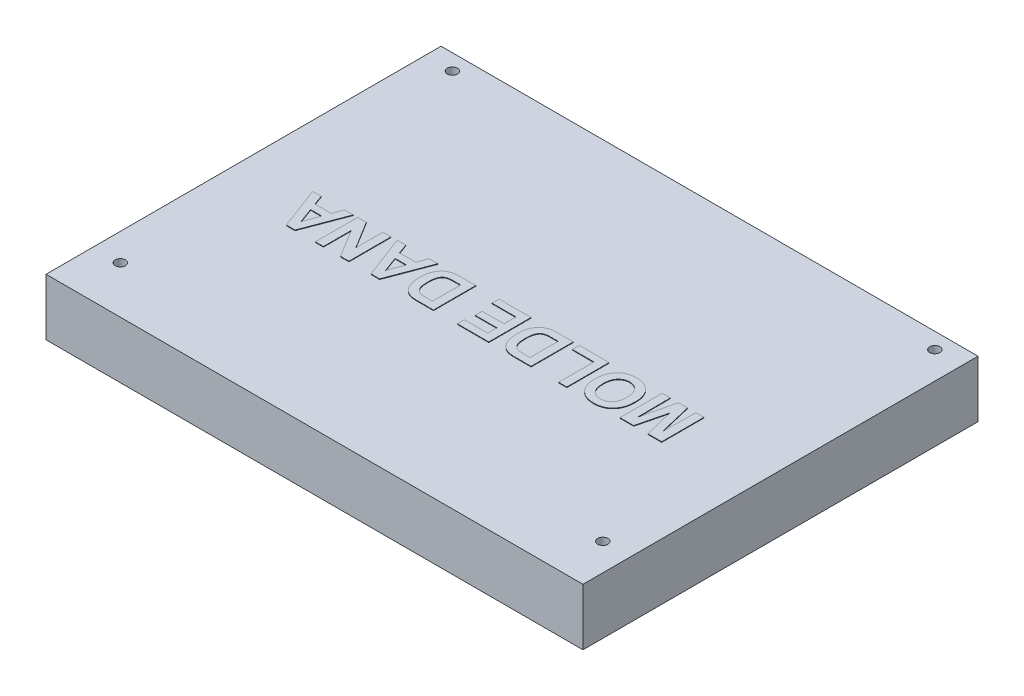
from build123d import *

# Parameters (mm, degrees)
CROQUIS1_W              = 946
CROQUIS1_H              = 696
SALIENTE_EXTRUIR1_DEPTH = 100
CROQUIS2_R              = 9
CORTAR_EXTRUIR1_DEPTH   = 120
SALIENTE_EXTRUIR2_DEPTH = 1


with BuildPart() as part:
    # Croquis1 → Saliente-Extruir1 (new body)
    with BuildSketch(Plane(origin=(0, 0, 0), x_dir=(1, 0, 0), z_dir=(0, 1, 0))):
        with Locations((473, -348)):
            Rectangle(CROQUIS1_W, CROQUIS1_H)
    extrude(amount=SALIENTE_EXTRUIR1_DEPTH)

    # Croquis2 → Cortar-Extruir1 (cut)
    with BuildSketch(Plane(origin=(0, 100, 0), x_dir=(1, 0, 0), z_dir=(0, 1, 0))):
        with Locations(Location((48, -28, 0), (0, 0, 270))):
            Circle(CROQUIS2_R)
        with Locations(Location((898, -28, 0), (0, 0, 270))):
            Circle(CROQUIS2_R)
        with Locations(Location((48, -613, 0), (0, 0, 270))):
            Circle(CROQUIS2_R)
        with Locations(Location((898, -613, 0), (0, 0, 270))):
            Circle(CROQUIS2_R)
    extrude(amount=-CORTAR_EXTRUIR1_DEPTH, mode=Mode.SUBTRACT)

    # Croquis3 → Saliente-Extruir2 (add)
    # profile 1 of 9: a face of its own
    with BuildSketch(Plane(origin=(0, 100, 0), x_dir=(1, 0, 0), z_dir=(0, 1, 0))):
        Polygon((798.887818585, -335.700738439), (798.887818585, -410.181980301), (774.657542787, -410.181980301), (762.124641512, -359.378969777), (749.591740237, -410.181980301), (725.361464439, -410.181980301), (725.361464439, -335.700738439), (739.684780182, -335.700738439), (740.16222404, -394.336812261), (754.14237701, -335.700738439), (770.106906014, -335.700738439), (784.087058984, -394.336812261), (784.564502842, -335.700738439), align=None)
    # profile 2 of 9: a face of its own
    with BuildSketch(Plane(origin=(0, 100, 0), x_dir=(1, 0, 0), z_dir=(0, 1, 0))):
        with BuildLine():
            add(Edge.make_bspline(
                [(714.857699561, -372.493755753), (714.852428828, -373.414164201), (714.842077788, -375.221727585), (714.662718292, -377.873490928), (714.426308503, -380.415305104), (714.041315543, -382.837172219), (713.588423265, -385.150427442), (713.021975224, -387.354384123), (712.339605922, -389.441313045), (711.796775742, -390.773794605), (711.530512675, -391.427388751)],
                knots=[0, 0, 0, 0, 1.141009212, 2.240794809, 3.294380675, 4.305229195, 5.280013876, 6.216333343, 7.125095522, 8, 8, 8, 8], degree=3))
            add(Edge.make_bspline(
                [(711.530512675, -391.427388751), (711.095480699, -392.356695793), (710.230533434, -394.204379706), (708.618251174, -396.816123835), (706.805655437, -399.289347503), (704.784677128, -401.591628838), (702.606242973, -403.680677599), (700.284978991, -405.482738713), (697.881833428, -407.040419256), (696.17328357, -407.82434717), (695.327261741, -408.212524387)],
                knots=[0, 0, 0, 0, 1.031298788, 2.050467816, 3.080965632, 4.112446372, 5.127889083, 6.11150152, 7.064873096, 8, 8, 8, 8], degree=3))
            add(Edge.make_bspline(
                [(695.327261741, -408.212524387), (694.752952457, -408.448093241), (693.592126959, -408.924237958), (691.788067496, -409.518491515), (689.915556915, -410.001295669), (687.988138966, -410.432866331), (685.987100029, -410.730448503), (683.928609336, -410.979960924), (681.801401466, -411.110734725), (680.362531091, -411.128062178), (679.631294906, -411.136868018)],
                knots=[0, 0, 0, 0, 0.92659354, 1.872881803, 2.832850937, 3.813025581, 4.820167273, 5.851730198, 6.908245912, 8, 8, 8, 8], degree=3))
            add(Edge.make_bspline(
                [(679.631294906, -411.136868018), (678.321959841, -411.10404732), (675.759573122, -411.039816762), (672.016646521, -410.5758862), (668.474698355, -409.792499061), (665.145732787, -408.660206351), (662.000995707, -407.244843413), (659.065112994, -405.489145774), (656.333018538, -403.412570376), (653.812712687, -401.041875011), (651.536817604, -398.389829724), (649.58296911, -395.453064358), (647.893630337, -392.292197444), (646.545652542, -388.86846156), (645.476432475, -385.2091067), (644.753360681, -381.299307222), (644.269583066, -377.150992311), (644.220970136, -374.300551446), (644.196008564, -372.836918526)],
                knots=[0, 0, 0, 0, 1.064696, 2.083624705, 3.061957999, 4.009747969, 4.938330204, 5.861603005, 6.7854338, 7.723969795, 8.670714893, 9.62089252, 10.587110806, 11.580050613, 12.60789951, 13.682772805, 14.810159493, 16, 16, 16, 16], degree=3))
            add(Edge.make_bspline(
                [(644.196008564, -372.836918526), (644.222790782, -371.383426738), (644.274930757, -368.553749779), (644.733237149, -364.432893143), (645.464305044, -360.549477374), (646.530208551, -356.916347279), (647.866633654, -353.512542352), (649.53812135, -350.370372913), (651.476260104, -347.447381555), (653.743382419, -344.811791892), (656.237358275, -342.438187973), (658.96338644, -340.385272187), (661.868536596, -338.619495665), (664.997626323, -337.201053723), (668.324336575, -336.097387637), (671.847024819, -335.306492304), (675.570564481, -334.842452182), (678.118068741, -334.778562698), (679.422413218, -334.745850723)],
                knots=[0, 0, 0, 0, 1.188494359, 2.313776472, 3.386789709, 4.416594438, 5.406132604, 6.372361755, 7.322313154, 8.268721933, 9.209651099, 10.133050987, 11.054612279, 11.984787818, 12.936688123, 13.916631539, 14.933297114, 16, 16, 16, 16], degree=3))
            add(Edge.make_bspline(
                [(679.422413218, -334.745850723), (680.741557293, -334.779094807), (683.323501215, -334.84416303), (687.093062907, -335.301740092), (690.650615346, -336.103386686), (694.011370981, -337.17668136), (697.151550532, -338.61401314), (700.09116678, -340.342573395), (702.810213389, -342.410886125), (705.310813149, -344.765306973), (707.57735218, -347.387375809), (709.511271312, -350.292621218), (711.187762912, -353.406988382), (712.520507469, -356.777564246), (713.590090026, -360.369694056), (714.319107211, -364.20404046), (714.779133909, -368.270052222), (714.831032335, -371.06012091), (714.857699561, -372.493755753)],
                knots=[0, 0, 0, 0, 1.08084049, 2.115515346, 3.105177409, 4.065258586, 5.000819201, 5.92894832, 6.854012731, 7.793841493, 8.738859725, 9.687140885, 10.647913701, 11.631668285, 12.651600344, 13.714546555, 14.825654111, 16, 16, 16, 16], degree=3))
        make_face()
        with BuildLine():
            add(Edge.make_bspline(
                [(700.534383818, -372.986119732), (700.520083699, -371.955843467), (700.49239179, -369.96073308), (700.19713892, -367.064942854), (699.749660286, -364.357549625), (699.089551764, -361.842690295), (698.261604188, -359.51283001), (697.225471036, -357.384892459), (696.017288866, -355.438849945), (694.605547049, -353.712607316), (693.06566295, -352.174287535), (691.428577223, -350.823367943), (689.673898183, -349.692091398), (687.823313077, -348.764415077), (685.868911957, -348.050380938), (683.823270179, -347.51527508), (681.66893423, -347.2228342), (680.199072949, -347.180765601), (679.45225346, -347.159391034)],
                knots=[0, 0, 0, 0, 1.313926443, 2.544393562, 3.709525234, 4.811404508, 5.857066262, 6.858762239, 7.825215948, 8.772527565, 9.696737363, 10.598503724, 11.474937107, 12.35455699, 13.23381067, 14.12482115, 15.047243349, 16, 16, 16, 16], degree=3))
            add(Edge.make_bspline(
                [(679.45225346, -347.159391034), (678.705331221, -347.18032999), (677.235267715, -347.221541235), (675.083609048, -347.52001655), (673.03379973, -348.032091123), (671.087530973, -348.743078655), (669.2549541, -349.685732091), (667.511092345, -350.803718038), (665.884951116, -352.145506873), (664.352700989, -353.664075764), (662.978964335, -355.400828544), (661.778938512, -357.343187989), (660.758620838, -359.488197062), (659.954572785, -361.846344276), (659.281560354, -364.390338294), (658.860669742, -367.151419884), (658.560571832, -370.10488934), (658.533343023, -372.144771026), (658.519324306, -373.19500142)],
                knots=[0, 0, 0, 0, 0.949335378, 1.868445233, 2.754701665, 3.630798016, 4.495968556, 5.369254738, 6.258887054, 7.1708374, 8.106838367, 9.066474704, 10.067532548, 11.119232831, 12.229391465, 13.408003623, 14.665514087, 16, 16, 16, 16], degree=3))
            add(Edge.make_bspline(
                [(658.519324306, -373.19500142), (658.535359813, -374.235044059), (658.566414094, -376.249185457), (658.837235399, -379.166012476), (659.279950429, -381.879911225), (659.899235797, -384.393668154), (660.706941214, -386.700231531), (661.674382848, -388.814203935), (662.841093015, -390.718357423), (664.189705637, -392.411892693), (665.691557352, -393.893122107), (667.308760848, -395.181099041), (669.039906937, -396.285533102), (670.893172852, -397.179844255), (672.870976537, -397.871943887), (674.962371534, -398.356473997), (677.170368865, -398.664050858), (678.680342495, -398.703275664), (679.45225346, -398.723327707)],
                knots=[0, 0, 0, 0, 1.332005769, 2.579555744, 3.748367139, 4.851568227, 5.891207845, 6.874533533, 7.824010729, 8.744315661, 9.640762401, 10.520275634, 11.388035792, 12.265608818, 13.150114554, 14.066441968, 15.011549198, 16, 16, 16, 16], degree=3))
            add(Edge.make_bspline(
                [(679.45225346, -398.723327707), (680.224173574, -398.703316192), (681.734165101, -398.664170668), (683.942034008, -398.356024918), (686.040086235, -397.872120865), (688.023997568, -397.16877603), (689.87804104, -396.248899974), (691.629920443, -395.153290594), (693.262337259, -393.84747191), (694.769421719, -392.337459277), (696.139227876, -390.630043495), (697.320673053, -388.703186273), (698.31590209, -386.573497296), (699.14367366, -384.247048977), (699.753025338, -381.713733497), (700.222309841, -378.988753465), (700.485620675, -376.054908662), (700.517780087, -374.031034875), (700.534383818, -372.986119732)],
                knots=[0, 0, 0, 0, 0.981836838, 1.920620126, 2.830816172, 3.717479053, 4.591954799, 5.459257691, 6.341778587, 7.245639417, 8.16867914, 9.120509358, 10.114083048, 11.154838822, 12.256798236, 13.425077972, 14.670581616, 16, 16, 16, 16], degree=3))
        make_face(mode=Mode.SUBTRACT)
    # profile 3 of 9: a face of its own
    with BuildSketch(Plane(origin=(0, 100, 0), x_dir=(1, 0, 0), z_dir=(0, 1, 0))):
        Polygon((631.782468253, -335.700738439), (631.782468253, -410.181980301), (617.459152511, -410.181980301), (617.459152511, -348.11427875), (579.263643864, -348.11427875), (579.263643864, -335.700738439), align=None)
    # profile 4 of 9: a face of its own
    with BuildSketch(Plane(origin=(0, 100, 0), x_dir=(1, 0, 0), z_dir=(0, 1, 0))):
        with BuildLine():
            Line((568.759878986, -410.181980301), (541.441138231, -410.181980301))
            add(Edge.make_bspline(
                [(541.441138231, -410.181980301), (540.695019069, -410.182367098), (539.242151745, -410.18312028), (537.133660888, -410.095648533), (535.161950861, -410.007663462), (533.332680959, -409.831536591), (531.639504891, -409.6469244), (530.079384295, -409.413191472), (528.662174554, -409.113637144), (527.768482895, -408.877402723), (527.341624296, -408.764568848)],
                knots=[0, 0, 0, 0, 1.259756885, 2.453039283, 3.563158368, 4.591894114, 5.55549294, 6.43918076, 7.254497783, 8, 8, 8, 8], degree=3))
            add(Edge.make_bspline(
                [(527.341624296, -408.764568848), (526.806888449, -408.592717936), (525.745278458, -408.251542671), (524.203956264, -407.614414732), (522.714222429, -406.906660229), (521.284945855, -406.091228808), (519.916410618, -405.187504074), (518.613250111, -404.175811703), (517.358365416, -403.089660238), (515.762313821, -401.51241912), (513.939797651, -399.32432632), (512.021816066, -396.433299491), (510.393933592, -393.256700081), (509.266833511, -390.415244959), (508.518688017, -387.989445477), (508.027187023, -386.042154142), (507.608773711, -383.99160098), (507.289969812, -381.833276789), (507.017702799, -379.58021865), (506.821866174, -377.221469837), (506.725001879, -374.757454605), (506.703266702, -373.080681621), (506.692177434, -372.225193583)],
                knots=[0, 0, 0, 0, 0.745437516, 1.479915586, 2.212342825, 2.933884924, 3.662761667, 4.387830047, 5.122664198, 5.865054076, 7.364851172, 8.894026813, 10.462180337, 12.095418849, 12.945463798, 13.83107854, 14.760859785, 15.72272455, 16.726836642, 17.773636107, 18.864111184, 20, 20, 20, 20], degree=3))
            add(Edge.make_bspline(
                [(506.692177434, -372.225193583), (506.721672911, -370.747065787), (506.778802163, -367.884107003), (507.191654128, -363.75227369), (507.889135611, -359.92828101), (508.610434111, -357.538374399), (508.96003576, -356.380025543)],
                knots=[0, 0, 0, 0, 1.103478992, 2.137308345, 3.097183656, 4, 4, 4, 4], degree=3))
            add(Edge.make_bspline(
                [(508.96003576, -356.380025543), (509.197022749, -355.715998632), (509.664750873, -354.405445415), (510.471922077, -352.512792589), (511.350585101, -350.718100625), (512.310032837, -349.025931129), (513.340135004, -347.426005299), (514.442678816, -345.918711622), (515.618526819, -344.507243892), (516.473370477, -343.647219356), (516.897539901, -343.220479204)],
                knots=[0, 0, 0, 0, 1.090745555, 2.152744224, 3.18177742, 4.181148221, 5.160920147, 6.124449529, 7.06936063, 8, 8, 8, 8], degree=3))
            add(Edge.make_bspline(
                [(516.897539901, -343.220479204), (517.587568894, -342.597810335), (518.999854143, -341.323391335), (521.503141463, -339.755668271), (524.306501704, -338.353227599), (526.34731969, -337.647002683), (527.401304779, -337.282271219)],
                knots=[0, 0, 0, 0, 0.914965274, 1.872663283, 2.901332116, 4, 4, 4, 4], degree=3))
            add(Edge.make_bspline(
                [(527.401304779, -337.282271219), (527.827349622, -337.15153502), (528.71158365, -336.880198803), (530.113340634, -336.588305704), (531.611639237, -336.290343137), (533.21635675, -336.074607972), (534.923914457, -335.913470875), (536.73500742, -335.794924764), (538.650461523, -335.720309394), (539.963977668, -335.707358819), (540.63545172, -335.700738439)],
                knots=[0, 0, 0, 0, 0.799100722, 1.658492201, 2.566706013, 3.539587476, 4.561478358, 5.643459719, 6.795328357, 8, 8, 8, 8], degree=3))
            Line((540.63545172, -335.700738439), (568.759878986, -335.700738439))
            Line((568.759878986, -335.700738439), (568.759878986, -410.181980301))
        make_face()
        with BuildLine():
            Line((554.436563243, -397.768439991), (554.436563243, -348.11427875))
            Line((554.436563243, -348.11427875), (542.649667996, -348.11427875))
            add(Edge.make_bspline(
                [(542.649667996, -348.11427875), (542.117520577, -348.118499042), (541.092933505, -348.126624718), (539.610329775, -348.150501029), (538.247829412, -348.215138738), (536.998294819, -348.282092861), (535.864979012, -348.392712795), (534.842950748, -348.501511717), (533.937899148, -348.653719132), (533.378917038, -348.773869653), (533.115710955, -348.830444537)],
                knots=[0, 0, 0, 0, 1.333384787, 2.567275092, 3.714769766, 4.750907381, 5.701951617, 6.567520054, 7.325492842, 8, 8, 8, 8], degree=3))
            add(Edge.make_bspline(
                [(533.115710955, -348.830444537), (532.499252472, -348.994946242), (531.298553952, -349.315352171), (529.612651842, -350.029629202), (528.087127634, -350.891326299), (526.696433468, -351.927480008), (525.443130153, -353.236938649), (524.373282566, -354.911633568), (523.383166825, -356.908943523), (522.705135332, -358.820868644), (522.21844562, -360.528555448), (521.888996618, -361.961859127), (521.628641978, -363.512548775), (521.404703032, -365.174504374), (521.223755035, -366.945588737), (521.11116063, -368.832197539), (521.034314255, -370.832021392), (521.021885717, -372.205221981), (521.015493177, -372.911519129)],
                knots=[0, 0, 0, 0, 1.038686998, 2.023088296, 2.974059649, 3.888265163, 4.839857954, 5.909819677, 7.113156087, 8.466843969, 9.20827164, 10.006482943, 10.861893492, 11.769681931, 12.739021491, 13.762258324, 14.849031541, 16, 16, 16, 16], degree=3))
            add(Edge.make_bspline(
                [(521.015493177, -372.911519129), (521.021836512, -373.617818475), (521.034124749, -374.986053374), (521.110853865, -376.970965245), (521.222813736, -378.827866433), (521.40505743, -380.559045412), (521.625501231, -382.166918318), (521.888984491, -383.652767017), (522.216184516, -385.007102444), (522.704420157, -386.615225676), (523.436093283, -388.430221794), (524.471693791, -390.39329486), (525.672980983, -392.105475477), (527.046585082, -393.562949004), (528.611487695, -394.772869031), (530.361381991, -395.760774483), (532.302235607, -396.548447819), (533.68720776, -396.881264575), (534.398841324, -397.052274204)],
                knots=[0, 0, 0, 0, 1.117884641, 2.165553157, 3.143666585, 4.061650406, 4.919948675, 5.712017807, 6.448973763, 7.123780946, 8.370635809, 9.539807174, 10.629653594, 11.670885263, 12.697494018, 13.74805657, 14.842894765, 16, 16, 16, 16], degree=3))
            add(Edge.make_bspline(
                [(534.398841324, -397.052274204), (534.706769858, -397.109495822), (535.384710626, -397.235475923), (536.509694625, -397.382526868), (537.834463294, -397.492529858), (539.356035907, -397.602059205), (541.072824688, -397.667485983), (542.987402725, -397.733143158), (545.101499207, -397.756001088), (546.578637677, -397.764174543), (547.349505974, -397.768439991)],
                knots=[0, 0, 0, 0, 0.578739524, 1.274162912, 2.095457587, 3.035141998, 4.093102578, 5.270121571, 6.575369351, 8, 8, 8, 8], degree=3))
            Line((547.349505974, -397.768439991), (554.436563243, -397.768439991))
        make_face(mode=Mode.SUBTRACT)
    # profile 5 of 9: a face of its own
    with BuildSketch(Plane(origin=(0, 100, 0), x_dir=(1, 0, 0), z_dir=(0, 1, 0))):
        Polygon((494.278637124, -335.700738439), (494.278637124, -410.181980301), (438.895149585, -410.181980301), (438.895149585, -397.768439991), (479.955321381, -397.768439991), (479.955321381, -381.535348816), (441.759812734, -381.535348816), (441.759812734, -369.121808506), (479.955321381, -369.121808506), (479.955321381, -348.11427875), (437.940261869, -348.11427875), (437.940261869, -335.700738439), align=None)
    # profile 6 of 9: a face of its own
    with BuildSketch(Plane(origin=(0, 100, 0), x_dir=(1, 0, 0), z_dir=(0, 1, 0))):
        with BuildLine():
            Line((396.880090073, -410.181980301), (369.561349318, -410.181980301))
            add(Edge.make_bspline(
                [(369.561349318, -410.181980301), (368.815230157, -410.182367098), (367.362362833, -410.18312028), (365.253871975, -410.095648533), (363.282161949, -410.007663462), (361.452892046, -409.831536591), (359.759715978, -409.6469244), (358.199595383, -409.413191472), (356.782385642, -409.113637144), (355.888693983, -408.877402723), (355.461835384, -408.764568848)],
                knots=[0, 0, 0, 0, 1.259756885, 2.453039283, 3.563158368, 4.591894114, 5.55549294, 6.43918076, 7.254497783, 8, 8, 8, 8], degree=3))
            add(Edge.make_bspline(
                [(355.461835384, -408.764568848), (354.927099537, -408.592717936), (353.865489546, -408.251542671), (352.324167351, -407.614414732), (350.834433517, -406.906660229), (349.405156943, -406.091228808), (348.036621706, -405.187504074), (346.733461198, -404.175811703), (345.478576504, -403.089660238), (343.882524908, -401.51241912), (342.060008738, -399.32432632), (340.142027154, -396.433299491), (338.51414468, -393.256700081), (337.387044598, -390.415244959), (336.638899105, -387.989445477), (336.14739811, -386.042154142), (335.728984799, -383.99160098), (335.4101809, -381.833276789), (335.137913887, -379.58021865), (334.942077262, -377.221469837), (334.845212967, -374.757454605), (334.823477789, -373.080681621), (334.812388522, -372.225193583)],
                knots=[0, 0, 0, 0, 0.745437516, 1.479915586, 2.212342825, 2.933884924, 3.662761667, 4.387830047, 5.122664198, 5.865054076, 7.364851172, 8.894026813, 10.462180337, 12.095418849, 12.945463798, 13.83107854, 14.760859785, 15.72272455, 16.726836642, 17.773636107, 18.864111184, 20, 20, 20, 20], degree=3))
            add(Edge.make_bspline(
                [(334.812388522, -372.225193583), (334.841883999, -370.747065787), (334.89901325, -367.884107003), (335.311865216, -363.75227369), (336.009346698, -359.92828101), (336.730645198, -357.538374399), (337.080246848, -356.380025543)],
                knots=[0, 0, 0, 0, 1.103478992, 2.137308345, 3.097183656, 4, 4, 4, 4], degree=3))
            add(Edge.make_bspline(
                [(337.080246848, -356.380025543), (337.317233837, -355.715998632), (337.78496196, -354.405445415), (338.592133165, -352.512792589), (339.470796189, -350.718100625), (340.430243925, -349.025931129), (341.460346092, -347.426005299), (342.562889904, -345.918711622), (343.738737907, -344.507243892), (344.593581564, -343.647219356), (345.017750988, -343.220479204)],
                knots=[0, 0, 0, 0, 1.090745555, 2.152744224, 3.18177742, 4.181148221, 5.160920147, 6.124449529, 7.06936063, 8, 8, 8, 8], degree=3))
            add(Edge.make_bspline(
                [(345.017750988, -343.220479204), (345.707779981, -342.597810335), (347.12006523, -341.323391335), (349.62335255, -339.755668271), (352.426712792, -338.353227599), (354.467530778, -337.647002683), (355.521515866, -337.282271219)],
                knots=[0, 0, 0, 0, 0.914965274, 1.872663283, 2.901332116, 4, 4, 4, 4], degree=3))
            add(Edge.make_bspline(
                [(355.521515866, -337.282271219), (355.94756071, -337.15153502), (356.831794738, -336.880198803), (358.233551721, -336.588305704), (359.731850324, -336.290343137), (361.336567838, -336.074607972), (363.044125545, -335.913470875), (364.855218508, -335.794924764), (366.770672611, -335.720309394), (368.084188756, -335.707358819), (368.755662808, -335.700738439)],
                knots=[0, 0, 0, 0, 0.799100722, 1.658492201, 2.566706013, 3.539587476, 4.561478358, 5.643459719, 6.795328357, 8, 8, 8, 8], degree=3))
            Line((368.755662808, -335.700738439), (396.880090073, -335.700738439))
            Line((396.880090073, -335.700738439), (396.880090073, -410.181980301))
        make_face()
        with BuildLine():
            Line((382.556774331, -397.768439991), (382.556774331, -348.11427875))
            Line((382.556774331, -348.11427875), (370.769879084, -348.11427875))
            add(Edge.make_bspline(
                [(370.769879084, -348.11427875), (370.237731664, -348.118499042), (369.213144592, -348.126624718), (367.730540863, -348.150501029), (366.368040499, -348.215138738), (365.118505907, -348.282092861), (363.985190099, -348.392712795), (362.963161836, -348.501511717), (362.058110236, -348.653719132), (361.499128125, -348.773869653), (361.235922043, -348.830444537)],
                knots=[0, 0, 0, 0, 1.333384787, 2.567275092, 3.714769766, 4.750907381, 5.701951617, 6.567520054, 7.325492842, 8, 8, 8, 8], degree=3))
            add(Edge.make_bspline(
                [(361.235922043, -348.830444537), (360.61946356, -348.994946242), (359.418765039, -349.315352171), (357.73286293, -350.029629202), (356.207338722, -350.891326299), (354.816644556, -351.927480008), (353.56334124, -353.236938649), (352.493493654, -354.911633568), (351.503377913, -356.908943523), (350.825346419, -358.820868644), (350.338656708, -360.528555448), (350.009207706, -361.961859127), (349.748853066, -363.512548775), (349.52491412, -365.174504374), (349.343966123, -366.945588737), (349.231371718, -368.832197539), (349.154525342, -370.832021392), (349.142096805, -372.205221981), (349.135704264, -372.911519129)],
                knots=[0, 0, 0, 0, 1.038686998, 2.023088296, 2.974059649, 3.888265163, 4.839857954, 5.909819677, 7.113156087, 8.466843969, 9.20827164, 10.006482943, 10.861893492, 11.769681931, 12.739021491, 13.762258324, 14.849031541, 16, 16, 16, 16], degree=3))
            add(Edge.make_bspline(
                [(349.135704264, -372.911519129), (349.1420476, -373.617818475), (349.154335836, -374.986053374), (349.231064953, -376.970965245), (349.343024824, -378.827866433), (349.525268518, -380.559045412), (349.745712319, -382.166918318), (350.009195579, -383.652767017), (350.336395604, -385.007102444), (350.824631245, -386.615225676), (351.556304371, -388.430221794), (352.591904879, -390.39329486), (353.793192071, -392.105475477), (355.16679617, -393.562949004), (356.731698782, -394.772869031), (358.481593079, -395.760774483), (360.422446695, -396.548447819), (361.807418848, -396.881264575), (362.519052412, -397.052274204)],
                knots=[0, 0, 0, 0, 1.117884641, 2.165553157, 3.143666585, 4.061650406, 4.919948675, 5.712017807, 6.448973763, 7.123780946, 8.370635809, 9.539807174, 10.629653594, 11.670885263, 12.697494018, 13.74805657, 14.842894765, 16, 16, 16, 16], degree=3))
            add(Edge.make_bspline(
                [(362.519052412, -397.052274204), (362.826980945, -397.109495822), (363.504921713, -397.235475923), (364.629905713, -397.382526868), (365.954674382, -397.492529858), (367.476246995, -397.602059205), (369.193035776, -397.667485983), (371.107613813, -397.733143158), (373.221710295, -397.756001088), (374.698848765, -397.764174543), (375.469717062, -397.768439991)],
                knots=[0, 0, 0, 0, 0.578739524, 1.274162912, 2.095457587, 3.035141998, 4.093102578, 5.270121571, 6.575369351, 8, 8, 8, 8], degree=3))
            Line((375.469717062, -397.768439991), (382.556774331, -397.768439991))
        make_face(mode=Mode.SUBTRACT)
    # profile 7 of 9: a face of its own
    with BuildSketch(Plane(origin=(0, 100, 0), x_dir=(1, 0, 0), z_dir=(0, 1, 0))):
        Polygon((258.421371227, -335.700738439), (273.610053963, -335.700738439), (279.891424721, -352.888717331), (308.478375724, -352.888717331), (314.759746482, -335.700738439), (330.037949941, -335.700738439), (301.883682434, -410.181980301), (286.709919819, -410.181980301), align=None)
        Polygon((284.442061493, -365.302257641), (294.229660584, -392.039113694), (303.987419434, -365.302257641), align=None, mode=Mode.SUBTRACT)
    # profile 8 of 9: a face of its own
    with BuildSketch(Plane(origin=(0, 100, 0), x_dir=(1, 0, 0), z_dir=(0, 1, 0))):
        Polygon((247.917606349, -335.700738439), (247.917606349, -410.181980301), (232.952725422, -410.181980301), (203.037883689, -361.214144606), (203.037883689, -410.181980301), (188.714567946, -410.181980301), (188.714567946, -335.700738439), (204.141972611, -335.700738439), (233.594290607, -383.892727865), (233.594290607, -335.700738439), align=None)
    # profile 9 of 9: a face of its own
    with BuildSketch(Plane(origin=(0, 100, 0), x_dir=(1, 0, 0), z_dir=(0, 1, 0))):
        Polygon((109.458887503, -335.700738439), (124.647570239, -335.700738439), (130.928940997, -352.888717331), (159.515892, -352.888717331), (165.797262758, -335.700738439), (181.075466217, -335.700738439), (152.92119871, -410.181980301), (137.747436095, -410.181980301), align=None)
        Polygon((135.479577769, -365.302257641), (145.26717686, -392.039113694), (155.02493571, -365.302257641), align=None, mode=Mode.SUBTRACT)
    extrude(amount=SALIENTE_EXTRUIR2_DEPTH)


solid = part.part
